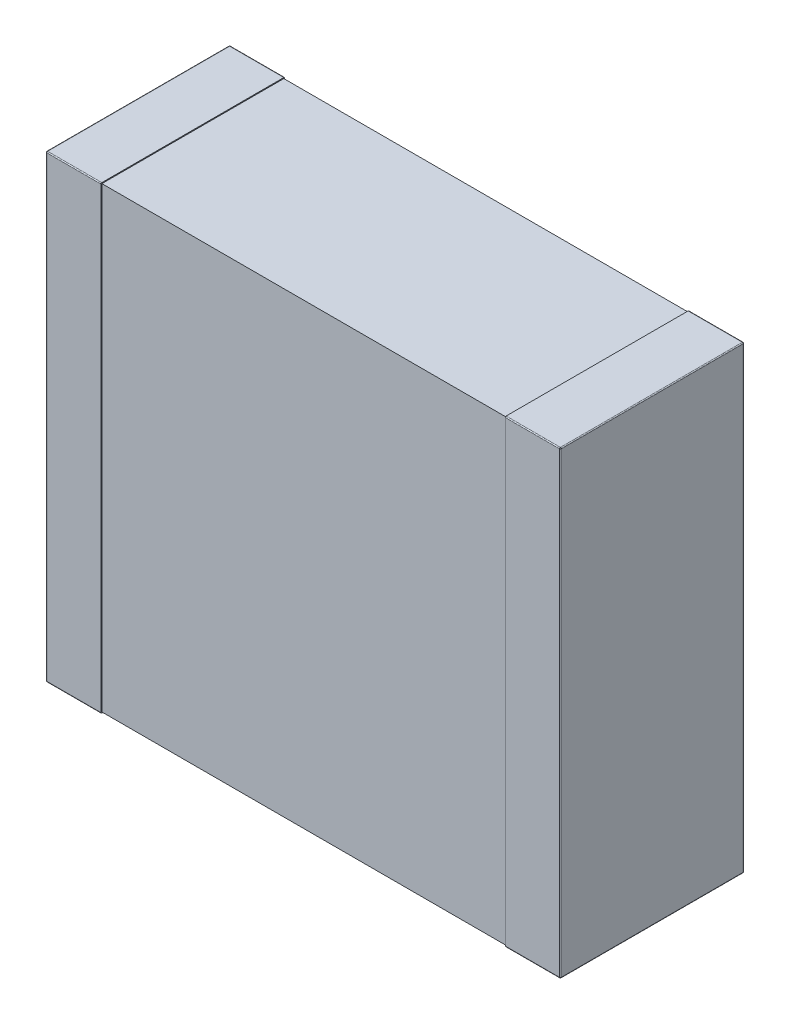
from build123d import *

# Parameters (mm, degrees)
SKETCH1_W            = 0.6
SKETCH1_H            = 5
THICKNESS_DEPTH      = 2
FILLET1_R            = 0.01
SKETCH2_W            = 1.98
SKETCH2_H            = 4.98
BOSS_EXTRUDE2_DEPTH  = 2.2
FILLET1_OF_MIRROR3_R = 0.01


with BuildPart() as part:
    # Sketch1 → THICKNESS (new body)
    with BuildSketch(Plane.XY):
        with Locations((-2.5, 0)):
            Rectangle(SKETCH1_W, SKETCH1_H)
    thickness = extrude(amount=THICKNESS_DEPTH)

    # Fillet1
    fillet1_edges = [part.edges().sort_by_distance(p)[0] for p in [
        (-2.5, 2.5, 2),
        (-2.8, 0, 2),
        (-2.5, 2.5, 0),
        (-2.5, -2.5, 0),
        (-2.8, 0, 0),
        (-2.5, -2.5, 2),
        (-2.8, 2.5, 1),
        (-2.8, -2.5, 1),
    ]]
    fillet(fillet1_edges, radius=FILLET1_R)

    # Sketch2 → Boss-Extrude2 (add)
    with BuildSketch(Plane(origin=(0, 0, 0), x_dir=(0, 0, -1), z_dir=(1, 0, 0))):
        with Locations((-1, 0)):
            Rectangle(SKETCH2_W, SKETCH2_H)
    boss_extrude2 = extrude(amount=-BOSS_EXTRUDE2_DEPTH)

    # Mirror3: THICKNESS, Boss-Extrude2 across plane
    add(thickness.mirror(Plane(origin=(0, 0, 0), x_dir=(0, 0, 1), z_dir=(1, 0, 0))))
    add(boss_extrude2.mirror(Plane(origin=(0, 0, 0), x_dir=(0, 0, 1), z_dir=(1, 0, 0))))

    # Fillet1 of Mirror3
    fillet1_of_mirror3_edges = [part.edges().sort_by_distance(p)[0] for p in [
        (2.5, 2.5, 2),
        (2.8, 0, 2),
        (2.5, 2.5, 0),
        (2.5, -2.5, 0),
        (2.8, 0, 0),
        (2.5, -2.5, 2),
        (2.8, 2.5, 1),
        (2.8, -2.5, 1),
    ]]
    fillet(fillet1_of_mirror3_edges, radius=FILLET1_OF_MIRROR3_R)


solid = part.part
